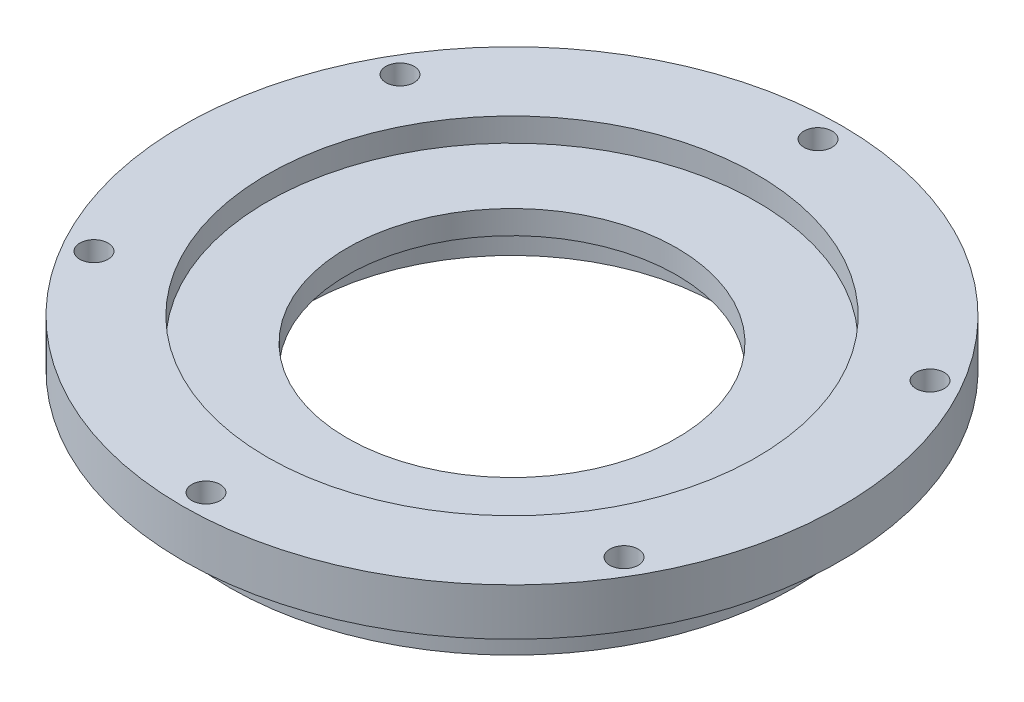
from build123d import *

# Parameters (mm, degrees)
SKETCH1_R           = 35
SKETCH1_R_2         = 17.5
BOSS_EXTRUDE1_DEPTH = 5
SKETCH2_R           = 30
SKETCH2_R_2         = 22
SKETCH2_R_3         = 1.6
BOSS_EXTRUDE2_DEPTH = 5
SKETCH3_R           = 1.5
CUT_EXTRUDE1_DEPTH  = 5
SKETCH4_R           = 26
CUT_EXTRUDE2_DEPTH  = 2.5


with BuildPart() as part:
    # Sketch1 → Boss-Extrude1 (new body)
    with BuildSketch(Plane(origin=(0, 0, 0), x_dir=(1, 0, 0), z_dir=(0, 1, 0))):
        with Locations(Location((0, 0, 0), (0, 0, 270))):
            Circle(SKETCH1_R)
        with Locations(Location((0, 0, 0), (0, 0, 270))):
            Circle(SKETCH1_R_2, mode=Mode.SUBTRACT)
    extrude(amount=BOSS_EXTRUDE1_DEPTH)

    # Sketch2 → Boss-Extrude2 (add)
    with BuildSketch(Plane.XZ):
        with Locations(Location((0, 0, 0), (0, 0, 90))):
            Circle(SKETCH2_R)
        with Locations(Location((0, 0, 0), (0, 0, 270))):
            Circle(SKETCH2_R_2, mode=Mode.SUBTRACT)
        with Locations(Location((0, 27.5, 0), (0, 0, 270))):
            Circle(SKETCH2_R_3, mode=Mode.SUBTRACT)
        with Locations(Location((5.535709302, 26.937073384, 0), (0, 0, 270))):
            Circle(SKETCH2_R_3, mode=Mode.SUBTRACT)
        with Locations(Location((10.844786016, 25.27133982, 0), (0, 0, 270))):
            Circle(SKETCH2_R_3, mode=Mode.SUBTRACT)
        with Locations(Location((15.709875915, 22.570994633, 0), (0, 0, 270))):
            Circle(SKETCH2_R_3, mode=Mode.SUBTRACT)
        with Locations(Location((19.931801649, 18.946590275, 0), (0, 0, 270))):
            Circle(SKETCH2_R_3, mode=Mode.SUBTRACT)
        with Locations(Location((23.337717081, 14.546510284, 0), (0, 0, 270))):
            Circle(SKETCH2_R_3, mode=Mode.SUBTRACT)
        with Locations(Location((25.788183634, 9.550894453, 0), (0, 0, 270))):
            Circle(SKETCH2_R_3, mode=Mode.SUBTRACT)
        with Locations(Location((27.182878919, 4.164263881, 0), (0, 0, 270))):
            Circle(SKETCH2_R_3, mode=Mode.SUBTRACT)
        with Locations(Location((27.464703947, -1.392852143, 0), (0, 0, 270))):
            Circle(SKETCH2_R_3, mode=Mode.SUBTRACT)
        with Locations(Location((26.622120769, -6.892944637, 0), (0, 0, 270))):
            Circle(SKETCH2_R_3, mode=Mode.SUBTRACT)
        with Locations(Location((24.689624838, -12.110839168, 0), (0, 0, 270))):
            Circle(SKETCH2_R_3, mode=Mode.SUBTRACT)
        with Locations(Location((21.746332766, -16.83291452, 0), (0, 0, 270))):
            Circle(SKETCH2_R_3, mode=Mode.SUBTRACT)
        with Locations(Location((17.912743275, -20.865848374, 0), (0, 0, 270))):
            Circle(SKETCH2_R_3, mode=Mode.SUBTRACT)
        with Locations(Location((13.34580397, -24.044531944, 0), (0, 0, 270))):
            Circle(SKETCH2_R_3, mode=Mode.SUBTRACT)
        with Locations(Location((8.232485882, -26.238829551, 0), (0, 0, 270))):
            Circle(SKETCH2_R_3, mode=Mode.SUBTRACT)
        with Locations(Location((2.782128855, -27.358906393, 0), (0, 0, 270))):
            Circle(SKETCH2_R_3, mode=Mode.SUBTRACT)
        with Locations(Location((-2.782128855, -27.358906393, 0), (0, 0, 270))):
            Circle(SKETCH2_R_3, mode=Mode.SUBTRACT)
        with Locations(Location((-8.232485882, -26.238829551, 0), (0, 0, 270))):
            Circle(SKETCH2_R_3, mode=Mode.SUBTRACT)
        with Locations(Location((-13.34580397, -24.044531944, 0), (0, 0, 270))):
            Circle(SKETCH2_R_3, mode=Mode.SUBTRACT)
        with Locations(Location((-17.912743275, -20.865848374, 0), (0, 0, 270))):
            Circle(SKETCH2_R_3, mode=Mode.SUBTRACT)
        with Locations(Location((-21.746332766, -16.83291452, 0), (0, 0, 270))):
            Circle(SKETCH2_R_3, mode=Mode.SUBTRACT)
        with Locations(Location((-24.689624838, -12.110839168, 0), (0, 0, 270))):
            Circle(SKETCH2_R_3, mode=Mode.SUBTRACT)
        with Locations(Location((-26.622120769, -6.892944637, 0), (0, 0, 270))):
            Circle(SKETCH2_R_3, mode=Mode.SUBTRACT)
        with Locations(Location((-27.464703947, -1.392852143, 0), (0, 0, 270))):
            Circle(SKETCH2_R_3, mode=Mode.SUBTRACT)
        with Locations(Location((-27.182878919, 4.164263881, 0), (0, 0, 270))):
            Circle(SKETCH2_R_3, mode=Mode.SUBTRACT)
        with Locations(Location((-25.788183634, 9.550894453, 0), (0, 0, 270))):
            Circle(SKETCH2_R_3, mode=Mode.SUBTRACT)
        with Locations(Location((-23.337717081, 14.546510284, 0), (0, 0, 270))):
            Circle(SKETCH2_R_3, mode=Mode.SUBTRACT)
        with Locations(Location((-19.931801649, 18.946590275, 0), (0, 0, 270))):
            Circle(SKETCH2_R_3, mode=Mode.SUBTRACT)
        with Locations(Location((-15.709875915, 22.570994633, 0), (0, 0, 270))):
            Circle(SKETCH2_R_3, mode=Mode.SUBTRACT)
        with Locations(Location((-10.844786016, 25.27133982, 0), (0, 0, 270))):
            Circle(SKETCH2_R_3, mode=Mode.SUBTRACT)
        with Locations(Location((-5.535709302, 26.937073384, 0), (0, 0, 270))):
            Circle(SKETCH2_R_3, mode=Mode.SUBTRACT)
    extrude(amount=BOSS_EXTRUDE2_DEPTH)

    # Sketch3 → Cut-Extrude1 (cut)
    with BuildSketch(Plane(origin=(0, 5, 0), x_dir=(1, 0, 0), z_dir=(0, 1, 0))):
        with Locations(Location((0, 32.5, 0), (0, 0, 270))):
            Circle(SKETCH3_R)
        with Locations(Location((28.145825623, 16.25, 0), (0, 0, 270))):
            Circle(SKETCH3_R)
        with Locations(Location((28.145825623, -16.25, 0), (0, 0, 270))):
            Circle(SKETCH3_R)
        with Locations(Location((0, -32.5, 0), (0, 0, 270))):
            Circle(SKETCH3_R)
        with Locations(Location((-28.145825623, -16.25, 0), (0, 0, 270))):
            Circle(SKETCH3_R)
        with Locations(Location((-28.145825623, 16.25, 0), (0, 0, 270))):
            Circle(SKETCH3_R)
    extrude(amount=-CUT_EXTRUDE1_DEPTH, mode=Mode.SUBTRACT)

    # Sketch4 → Cut-Extrude2 (cut)
    with BuildSketch(Plane(origin=(0, 5, 0), x_dir=(1, 0, 0), z_dir=(0, 1, 0))):
        with Locations(Location((0, 0, 0), (0, 0, 270))):
            Circle(SKETCH4_R)
    extrude(amount=-CUT_EXTRUDE2_DEPTH, mode=Mode.SUBTRACT)


solid = part.part
